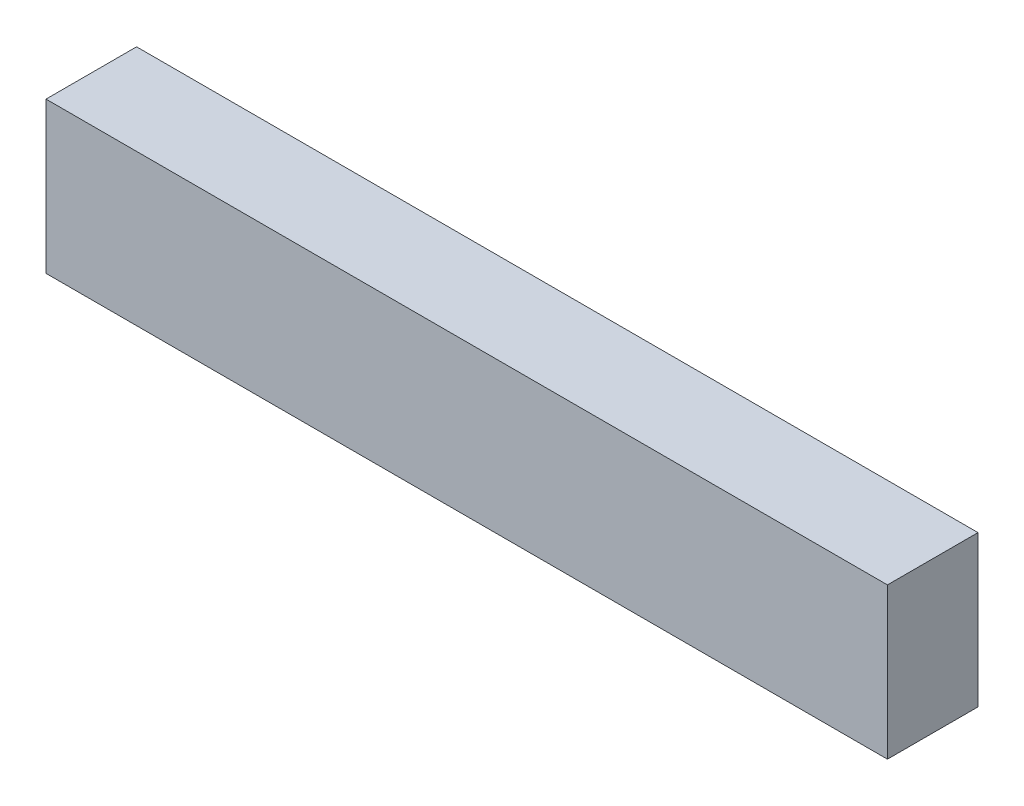
from build123d import *

# Parameters (mm, degrees)
SKETCH1_W           = 353.95
SKETCH1_H           = 63.5
BOSS_EXTRUDE1_DEPTH = 38.1


with BuildPart() as part:
    # Sketch1 → Boss-Extrude1 (new body)
    with BuildSketch(Plane.XY):
        with Locations((240.475, 95.25)):
            Rectangle(SKETCH1_W, SKETCH1_H)
    extrude(amount=BOSS_EXTRUDE1_DEPTH)


solid = part.part
